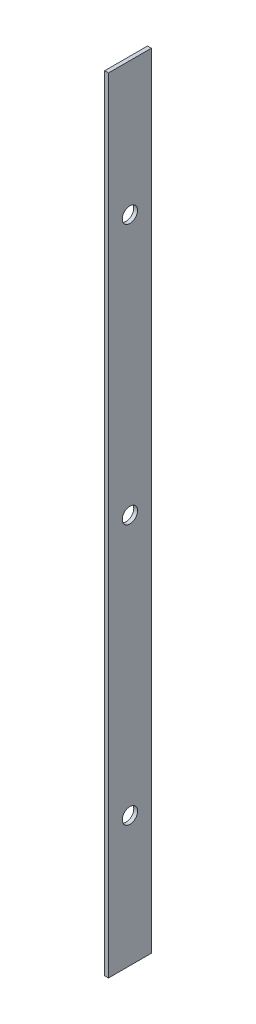
from build123d import *

# Parameters (mm, degrees)
SKETCH2_W           = 16.714
SKETCH2_H           = 306.109653219
SKETCH2_R           = 3
BOSS_EXTRUDE1_DEPTH = 1.5


with BuildPart() as part:
    # Sketch2 → Boss-Extrude1 (new body)
    with BuildSketch(Plane(origin=(0, 0, 0), x_dir=(0, 0, -1), z_dir=(1, 0, 0))):
        with Locations((-16.53652008, -7.091214147)):
            Rectangle(SKETCH2_W, SKETCH2_H)
        with Locations((-16.53652008, 93.853959243)):
            Circle(SKETCH2_R, mode=Mode.SUBTRACT)
        with Locations((-16.53652008, -7.746040757)):
            Circle(SKETCH2_R, mode=Mode.SUBTRACT)
        with Locations((-16.53652008, -109.346040757)):
            Circle(SKETCH2_R, mode=Mode.SUBTRACT)
    extrude(amount=BOSS_EXTRUDE1_DEPTH)


solid = part.part
